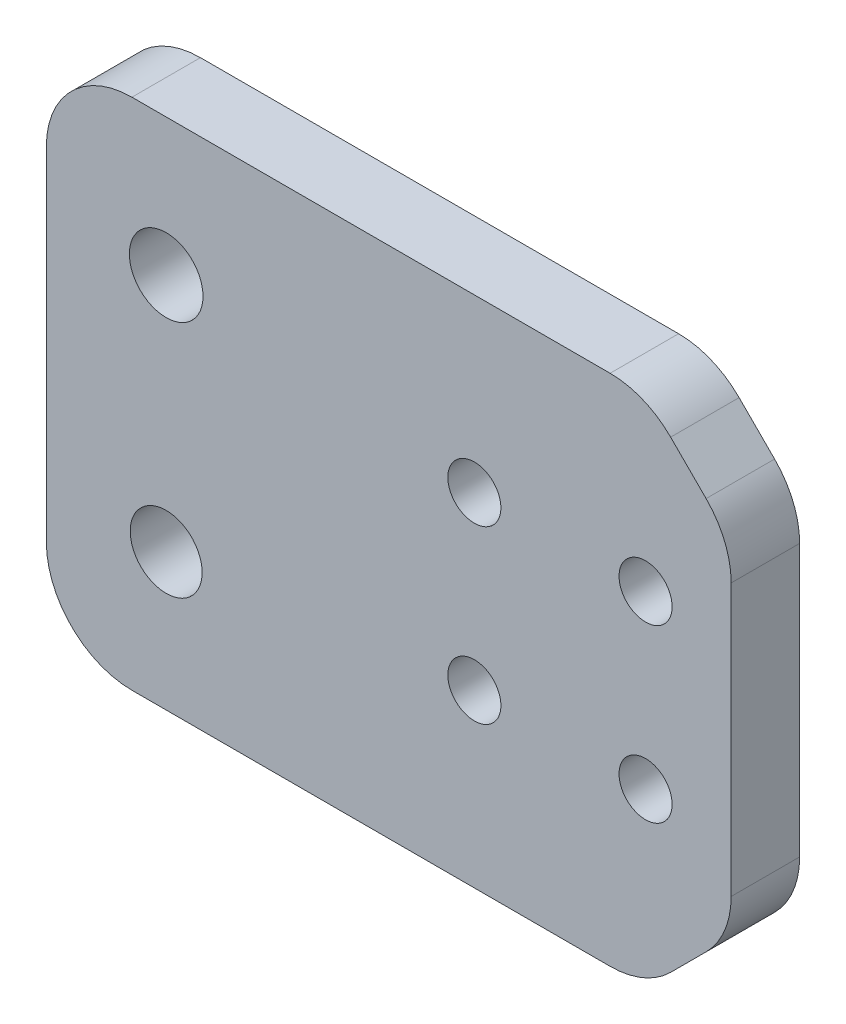
from build123d import *

# Parameters (mm, degrees)
SKETCH_1_W      = 40
SKETCH_1_H      = 30
SKETCH_1_R      = 2.15
SKETCH_1_R_2    = 2.1
SKETCH_1_R_3    = 1.55
EXTRUDE_1_DEPTH = 4
CHAMFER_1_SIZE  = 5
FILLET_1_R      = 5


with BuildPart() as part:
    # 草图1 → 凸台-拉伸1 (new body)
    with BuildSketch(Plane.XY):
        with Locations((20, 15)):
            Rectangle(SKETCH_1_W, SKETCH_1_H)
        with Locations((7, 22)):
            Circle(SKETCH_1_R, mode=Mode.SUBTRACT)
        with Locations((7, 8)):
            Circle(SKETCH_1_R_2, mode=Mode.SUBTRACT)
        with Locations((35, 20)):
            Circle(SKETCH_1_R_3, mode=Mode.SUBTRACT)
        with Locations((25, 20)):
            Circle(SKETCH_1_R_3, mode=Mode.SUBTRACT)
        with Locations((25, 10)):
            Circle(SKETCH_1_R_3, mode=Mode.SUBTRACT)
        with Locations((35, 10)):
            Circle(SKETCH_1_R_3, mode=Mode.SUBTRACT)
    extrude(amount=EXTRUDE_1_DEPTH)

    # 倒角1
    chamfer_1_edges = [part.edges().sort_by_distance(p)[0] for p in [
        (40, 30, 2),
        (40, 0, 2),
    ]]
    chamfer(chamfer_1_edges, length=CHAMFER_1_SIZE)

    # 圆角1
    fillet_1_edges = [part.edges().sort_by_distance(p)[0] for p in [
        (40, 25, 2),
        (40, 5, 2),
        (35, 0, 2),
        (35, 30, 2),
        (0, 30, 2),
        (0, 0, 2),
    ]]
    fillet(fillet_1_edges, radius=FILLET_1_R)


solid = part.part
